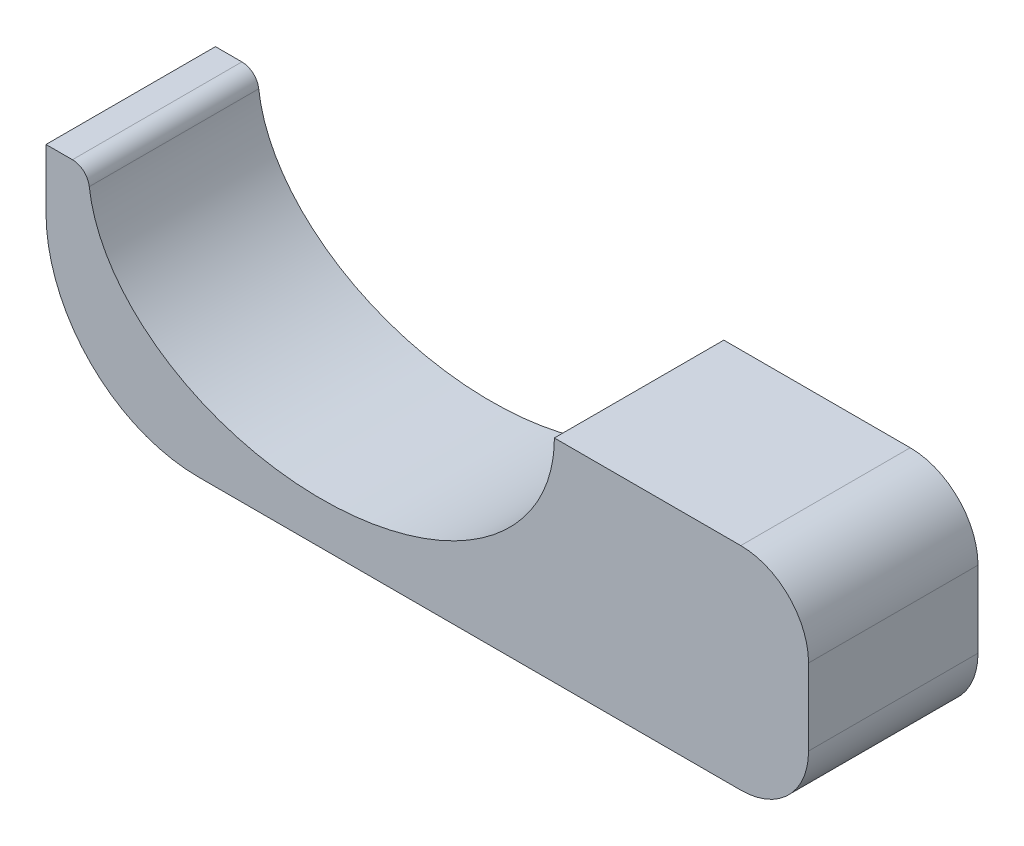
from build123d import *

# Parameters (mm, degrees)
SKETCH1_W           = 114.3
SKETCH1_H           = 25.4
BOSS_EXTRUDE1_DEPTH = 31.75
SKETCH2_RX          = 34.925
SKETCH2_RY          = 25.4
CUT_EXTRUDE1_DEPTH  = 71.138042459
FILLET1_R           = 2.54
FILLET2_R           = 22.86
FILLET3_R           = 10.16


with BuildPart() as part:
    # Sketch1 → Boss-Extrude1 (new body)
    with BuildSketch(Plane(origin=(0, 0, 0), x_dir=(1, 0, 0), z_dir=(0, 1, 0))):
        Rectangle(SKETCH1_W, SKETCH1_H)
    extrude(amount=BOSS_EXTRUDE1_DEPTH)

    # Sketch2 → Cut-Extrude1 (cut, through all)
    with BuildSketch(Plane.XY.offset(12.7)):
        with Locations(Location((-15.875, 31.75), (0, 0, 180))):
            Ellipse(SKETCH2_RX, SKETCH2_RY)
    extrude(amount=-CUT_EXTRUDE1_DEPTH, mode=Mode.SUBTRACT)

    # Fillet1
    fillet1_edges = [part.edges().sort_by_distance(p)[0] for p in [
        (-50.8, 31.75, 0),
    ]]
    fillet(fillet1_edges, radius=FILLET1_R)

    # Fillet2
    fillet2_edges = [part.edges().sort_by_distance(p)[0] for p in [
        (-57.15, 0, 0),
    ]]
    fillet(fillet2_edges, radius=FILLET2_R)

    # Fillet3
    fillet3_edges = [part.edges().sort_by_distance(p)[0] for p in [
        (57.15, 31.75, 0),
        (57.15, 0, 0),
    ]]
    fillet(fillet3_edges, radius=FILLET3_R)


solid = part.part
